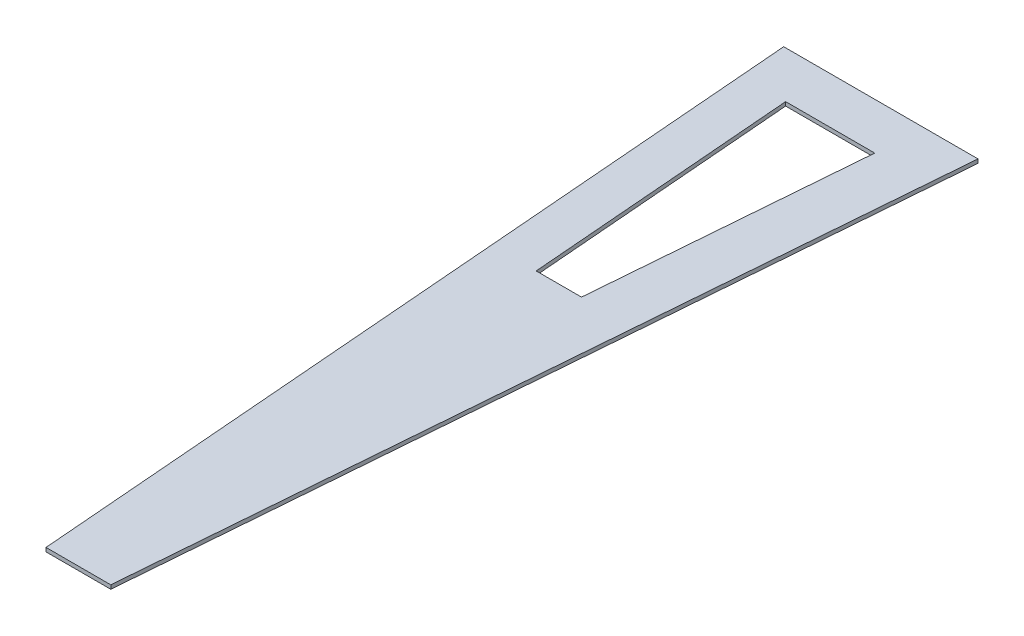
from build123d import *

# Parameters (mm, degrees)
BOSS_EXTRUDE1_DEPTH = 1.524
CUT_EXTRUDE1_DEPTH  = 1.524


with BuildPart() as part:
    # Sketch1 → Boss-Extrude1 (new body)
    with BuildSketch(Plane(origin=(0, 0, 0), x_dir=(1, 0, 0), z_dir=(0, 1, 0))):
        Polygon((0, 0), (76.2, 0), (50.8, -314.706), (25.4, -314.706), align=None)
    extrude(amount=BOSS_EXTRUDE1_DEPTH)

    # Sketch4 → Cut-Extrude1 (cut)
    with BuildSketch(Plane(origin=(0, 0, 0), x_dir=(-1, 0, 0), z_dir=(0, -1, 0))):
        Polygon((-27.61263984, -124.689571655), (-45.39263984, -124.689571655), (-53.982012586, -18.267243325), (-19.023267093, -18.267243325), align=None)
    extrude(amount=-CUT_EXTRUDE1_DEPTH, mode=Mode.SUBTRACT)


solid = part.part
